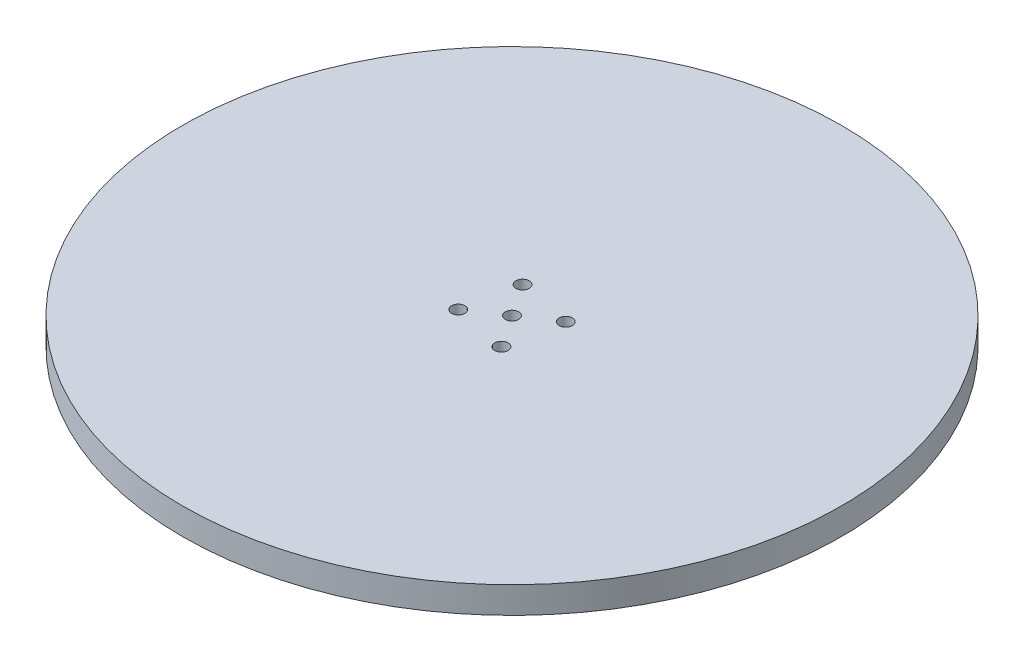
from build123d import *

# Parameters (mm, degrees)
SKETCH2_R               = 61.9125
BOSS_EXTRUDE1_DEPTH     = 5
SKETCH3_R               = 32.5
SKETCH3_R_2             = 23.5
BOSS_EXTRUDE2_DEPTH     = 7
SKETCH6_R               = 14.85
BOSS_EXTRUDE3_DEPTH     = 2
CUT_EXTRUDE1_DEPTH      = 2
CUT_EXTRUDE1_DEPTH_BACK = 5
SKETCH5_R               = 1.25


with BuildPart() as part:
    # Sketch2 → Boss-Extrude1 (new body)
    with BuildSketch(Plane(origin=(0, 0, 0), x_dir=(1, 0, 0), z_dir=(0, 1, 0))):
        with Locations(Location((0, 0, 0), (0, 0, 270))):
            Circle(SKETCH2_R)
    extrude(amount=BOSS_EXTRUDE1_DEPTH)

    # Sketch3 → Boss-Extrude2 (add)
    with BuildSketch(Plane(origin=(0, 0, 0), x_dir=(1, 0, 0), z_dir=(0, 1, 0))):
        with Locations(Location((0, 0, 0), (0, 0, 270))):
            Circle(SKETCH3_R)
        with Locations(Location((0, 0, 0), (0, 0, 270))):
            Circle(SKETCH3_R_2, mode=Mode.SUBTRACT)
    extrude(amount=-BOSS_EXTRUDE2_DEPTH)

    # Sketch6 → Boss-Extrude3 (add)
    with BuildSketch(Plane(origin=(0, 0, 0), x_dir=(1, 0, 0), z_dir=(0, 1, 0))):
        with Locations(Location((0, 0, 0), (0, 0, 270))):
            Circle(SKETCH6_R)
    extrude(amount=-BOSS_EXTRUDE3_DEPTH)

    # Sketch5 → Cut-Extrude1 (cut, two sides: drawn at the far end of the back side and taken through both)
    with BuildSketch(Plane(origin=(0, 0, 0), x_dir=(-1, 0, 0), z_dir=(0, -1, 0)).offset(-CUT_EXTRUDE1_DEPTH_BACK)):
        with Locations(Location((0, 0, 0), (0, 0, 90))):
            Circle(SKETCH5_R)
        with Locations(Location((-4.058493048, -6.043759937, 0), (0, 0, 90))):
            Circle(SKETCH5_R)
        with Locations(Location((-6.043759937, 4.058493048, 0), (0, 0, 90))):
            Circle(SKETCH5_R)
        with Locations(Location((4.058493048, 6.043759937, 0), (0, 0, 90))):
            Circle(SKETCH5_R)
        with Locations(Location((6.043759937, -4.058493048, 0), (0, 0, 90))):
            Circle(SKETCH5_R)
    extrude(amount=CUT_EXTRUDE1_DEPTH + CUT_EXTRUDE1_DEPTH_BACK, mode=Mode.SUBTRACT)


solid = part.part
